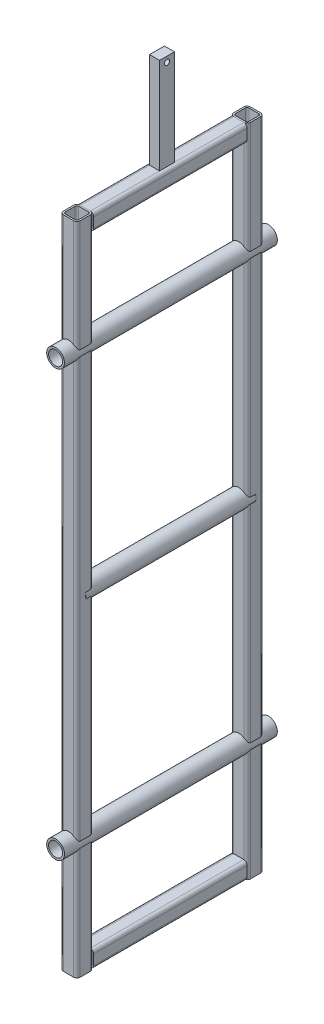
from build123d import *

# Parameters (mm, degrees)
SKETCH136_R                          = 10.65
SKETCH136_R_2                        = 8.35
PIPE_21_3_X_2_3_1_DEPTH              = 203.2
SKETCH136_ON_SEGMENT_2_R             = 10.65
SKETCH136_ON_SEGMENT_2_R_2           = 8.35
PIPE_21_3_X_2_3_1_2_DEPTH            = 254
SKETCH136_ON_SEGMENT_3_R             = 10.65
SKETCH136_ON_SEGMENT_3_R_2           = 8.35
PIPE_21_3_X_2_3_1_3_DEPTH            = 254
SQUARE_TUBE_20_X_20_X_2_7_DEPTH      = 772
SQUARE_TUBE_20_X_20_X_2_7_DEPTH_BACK = 10
SQUARE_TUBE_20_X_20_X_2_7_2_DEPTH    = 782
SQUARE_TUBE_20_X_20_X_2_7_3_DEPTH    = 205.2
SQUARE_TUBE_20_X_20_X_2_7_4_DEPTH    = 205.2
SKETCH143_R                          = 8.35
CUT_EXTRUDE1_DEPTH                   = 467.380126613
SKETCH144_W                          = 12
SKETCH144_H                          = 17.78
BOSS_EXTRUDE1_DEPTH                  = 114.3
SKETCH145_R                          = 3.175
CUT_EXTRUDE2_DEPTH                   = 522.281413922


with BuildPart() as part:
    # Sketch136 → Pipe 21.3 X 2.3(1) (new body)
    with BuildSketch(Plane(origin=(0, 0, 101.6), x_dir=(1, 0, 0), z_dir=(0, 0, -1))):
        Circle(SKETCH136_R)
        Circle(SKETCH136_R_2, mode=Mode.SUBTRACT)
    extrude(amount=PIPE_21_3_X_2_3_1_DEPTH)


with BuildPart() as body_2:
    # Sketch136 on segment 2 (carried to segment 2) → Pipe 21.3 X 2.3_1 2 (new body)
    with BuildSketch(Plane(origin=(0, 254, 127), x_dir=(1, 0, 0), z_dir=(0, 0, -1))):
        Circle(SKETCH136_ON_SEGMENT_2_R)
        Circle(SKETCH136_ON_SEGMENT_2_R_2, mode=Mode.SUBTRACT)
    extrude(amount=PIPE_21_3_X_2_3_1_2_DEPTH)


with BuildPart() as body_3:
    # Sketch136 on segment 3 (carried to segment 3) → Pipe 21.3 X 2.3_1 3 (new body)
    with BuildSketch(Plane(origin=(0, -254, 127), x_dir=(1, 0, 0), z_dir=(0, 0, -1))):
        Circle(SKETCH136_ON_SEGMENT_3_R)
        Circle(SKETCH136_ON_SEGMENT_3_R_2, mode=Mode.SUBTRACT)
    extrude(amount=PIPE_21_3_X_2_3_1_3_DEPTH)


with BuildPart() as body_4:
    # Sketch141 → Square tube 20 X 20 X 2(7) (new, two sides: drawn at the far end of the back side and taken through both)
    with BuildSketch(Plane(origin=(0, -381, -101.6), x_dir=(1, 0, 0), z_dir=(0, 1, 0)).offset(-SQUARE_TUBE_20_X_20_X_2_7_DEPTH_BACK)):
        with BuildLine():
            Line((-6, -10), (6, -10))
            ThreePointArc((6, -10), (8.828427125, -8.828427125), (10, -6))
            Line((10, -6), (10, 6))
            ThreePointArc((10, 6), (8.828427125, 8.828427125), (6, 10))
            Line((6, 10), (-6, 10))
            ThreePointArc((-6, 10), (-8.828427125, 8.828427125), (-10, 6))
            Line((-10, 6), (-10, -6))
            ThreePointArc((-10, -6), (-8.828427125, -8.828427125), (-6, -10))
        make_face()
        with BuildLine():
            Line((-6, -8), (6, -8))
            ThreePointArc((6, -8), (7.414213562, -7.414213562), (8, -6))
            Line((8, -6), (8, 6))
            ThreePointArc((8, 6), (7.414213562, 7.414213562), (6, 8))
            Line((6, 8), (-6, 8))
            ThreePointArc((-6, 8), (-7.414213562, 7.414213562), (-8, 6))
            Line((-8, 6), (-8, -6))
            ThreePointArc((-8, -6), (-7.414213562, -7.414213562), (-6, -8))
        make_face(mode=Mode.SUBTRACT)
    extrude(amount=SQUARE_TUBE_20_X_20_X_2_7_DEPTH + SQUARE_TUBE_20_X_20_X_2_7_DEPTH_BACK)


with BuildPart() as body_5:
    # Sketch141 on segment 2 (carried to segment 2) → Square tube 20 X 20 X 2_7 2 (new body)
    with BuildSketch(Plane(origin=(0, -391, 101.6), x_dir=(1, 0, 0), z_dir=(0, 1, 0))):
        with BuildLine():
            Line((-6, -10), (6, -10))
            ThreePointArc((6, -10), (8.828427125, -8.828427125), (10, -6))
            Line((10, -6), (10, 6))
            ThreePointArc((10, 6), (8.828427125, 8.828427125), (6, 10))
            Line((6, 10), (-6, 10))
            ThreePointArc((-6, 10), (-8.828427125, 8.828427125), (-10, 6))
            Line((-10, 6), (-10, -6))
            ThreePointArc((-10, -6), (-8.828427125, -8.828427125), (-6, -10))
        make_face()
        with BuildLine():
            Line((-6, -8), (6, -8))
            ThreePointArc((6, -8), (7.414213562, -7.414213562), (8, -6))
            Line((8, -6), (8, 6))
            ThreePointArc((8, 6), (7.414213562, 7.414213562), (6, 8))
            Line((6, 8), (-6, 8))
            ThreePointArc((-6, 8), (-7.414213562, 7.414213562), (-8, 6))
            Line((-8, 6), (-8, -6))
            ThreePointArc((-8, -6), (-7.414213562, -7.414213562), (-6, -8))
        make_face(mode=Mode.SUBTRACT)
    extrude(amount=SQUARE_TUBE_20_X_20_X_2_7_2_DEPTH)


with BuildPart() as body_6:
    # Sketch141 on segment 3 (carried to segment 3) → Square tube 20 X 20 X 2_7 3 (new body)
    with BuildSketch(Plane(origin=(0, -381, 102.6), x_dir=(1, 0, 0), z_dir=(0, 0, -1))):
        with BuildLine():
            Line((-6, -10), (6, -10))
            ThreePointArc((6, -10), (8.828427125, -8.828427125), (10, -6))
            Line((10, -6), (10, 6))
            ThreePointArc((10, 6), (8.828427125, 8.828427125), (6, 10))
            Line((6, 10), (-6, 10))
            ThreePointArc((-6, 10), (-8.828427125, 8.828427125), (-10, 6))
            Line((-10, 6), (-10, -6))
            ThreePointArc((-10, -6), (-8.828427125, -8.828427125), (-6, -10))
        make_face()
        with BuildLine():
            Line((-6, -8), (6, -8))
            ThreePointArc((6, -8), (7.414213562, -7.414213562), (8, -6))
            Line((8, -6), (8, 6))
            ThreePointArc((8, 6), (7.414213562, 7.414213562), (6, 8))
            Line((6, 8), (-6, 8))
            ThreePointArc((-6, 8), (-7.414213562, 7.414213562), (-8, 6))
            Line((-8, 6), (-8, -6))
            ThreePointArc((-8, -6), (-7.414213562, -7.414213562), (-6, -8))
        make_face(mode=Mode.SUBTRACT)
    extrude(amount=SQUARE_TUBE_20_X_20_X_2_7_3_DEPTH)

    # Square tube 20 X 20 X 2_7 3 end butt 1
    split(bisect_by=Plane(origin=(0, -381, 91.6), x_dir=(0, 1, 0), z_dir=(0, 0, -1)), keep=Keep.TOP)

    # Square tube 20 X 20 X 2_7 3 end butt 2
    split(bisect_by=Plane(origin=(0, -381, -91.6), x_dir=(0, -1, 0), z_dir=(0, 0, 1)), keep=Keep.TOP)


with BuildPart() as body_7:
    # Sketch141 on segment 4 (carried to segment 4) → Square tube 20 X 20 X 2_7 4 (new body)
    with BuildSketch(Plane(origin=(0, 381, 102.6), x_dir=(1, 0, 0), z_dir=(0, 0, -1))):
        with BuildLine():
            Line((-6, -10), (6, -10))
            ThreePointArc((6, -10), (8.828427125, -8.828427125), (10, -6))
            Line((10, -6), (10, 6))
            ThreePointArc((10, 6), (8.828427125, 8.828427125), (6, 10))
            Line((6, 10), (-6, 10))
            ThreePointArc((-6, 10), (-8.828427125, 8.828427125), (-10, 6))
            Line((-10, 6), (-10, -6))
            ThreePointArc((-10, -6), (-8.828427125, -8.828427125), (-6, -10))
        make_face()
        with BuildLine():
            Line((-6, -8), (6, -8))
            ThreePointArc((6, -8), (7.414213562, -7.414213562), (8, -6))
            Line((8, -6), (8, 6))
            ThreePointArc((8, 6), (7.414213562, 7.414213562), (6, 8))
            Line((6, 8), (-6, 8))
            ThreePointArc((-6, 8), (-7.414213562, 7.414213562), (-8, 6))
            Line((-8, 6), (-8, -6))
            ThreePointArc((-8, -6), (-7.414213562, -7.414213562), (-6, -8))
        make_face(mode=Mode.SUBTRACT)
    extrude(amount=SQUARE_TUBE_20_X_20_X_2_7_4_DEPTH)

    # Square tube 20 X 20 X 2_7 4 end butt 1
    split(bisect_by=Plane(origin=(0, 381, 91.6), x_dir=(0, 1, 0), z_dir=(0, 0, -1)), keep=Keep.TOP)

    # Square tube 20 X 20 X 2_7 4 end butt 2
    split(bisect_by=Plane(origin=(0, 381, -91.6), x_dir=(0, -1, 0), z_dir=(0, 0, 1)), keep=Keep.TOP)


with BuildPart() as cut_extrude1_tool:
    # Sketch143 → Cut-Extrude1 (new, through all)
    with BuildSketch(Plane(origin=(0, 0, -127), x_dir=(1, 0, 0), z_dir=(0, 0, -1))):
        with Locations(Location((0, 254, 0), (0, 0, 135.935955789))):
            Circle(SKETCH143_R)
        with Locations(Location((0, -254, 0), (0, 0, 224.064044211))):
            Circle(SKETCH143_R)
    extrude(amount=-CUT_EXTRUDE1_DEPTH)


with BuildPart() as body_4_1:
    add(body_4.part)

    # Cut-Extrude1: cut by cut_extrude1_tool
    add(cut_extrude1_tool.part, mode=Mode.SUBTRACT)


with BuildPart() as body_5_1:
    add(body_5.part)

    # Cut-Extrude1: cut by cut_extrude1_tool
    add(cut_extrude1_tool.part, mode=Mode.SUBTRACT)


with BuildPart() as body_8:
    # Sketch144 → Boss-Extrude1 (new body)
    with BuildSketch(Plane(origin=(0, 391, 0), x_dir=(-1, 0, 0), z_dir=(0, 1, 0))):
        Rectangle(SKETCH144_W, SKETCH144_H)
    extrude(amount=BOSS_EXTRUDE1_DEPTH)

    # Sketch145 → Cut-Extrude2 (cut, through all)
    with BuildSketch(Plane.YZ.offset(6)):
        with Locations(Location((498.95, 0, 0), (0, 0, 270))):
            Circle(SKETCH145_R)
    extrude(amount=-CUT_EXTRUDE2_DEPTH, mode=Mode.SUBTRACT)


solid = Compound([part.part, body_2.part, body_3.part, body_6.part, body_7.part, body_4_1.part, body_5_1.part, body_8.part])
